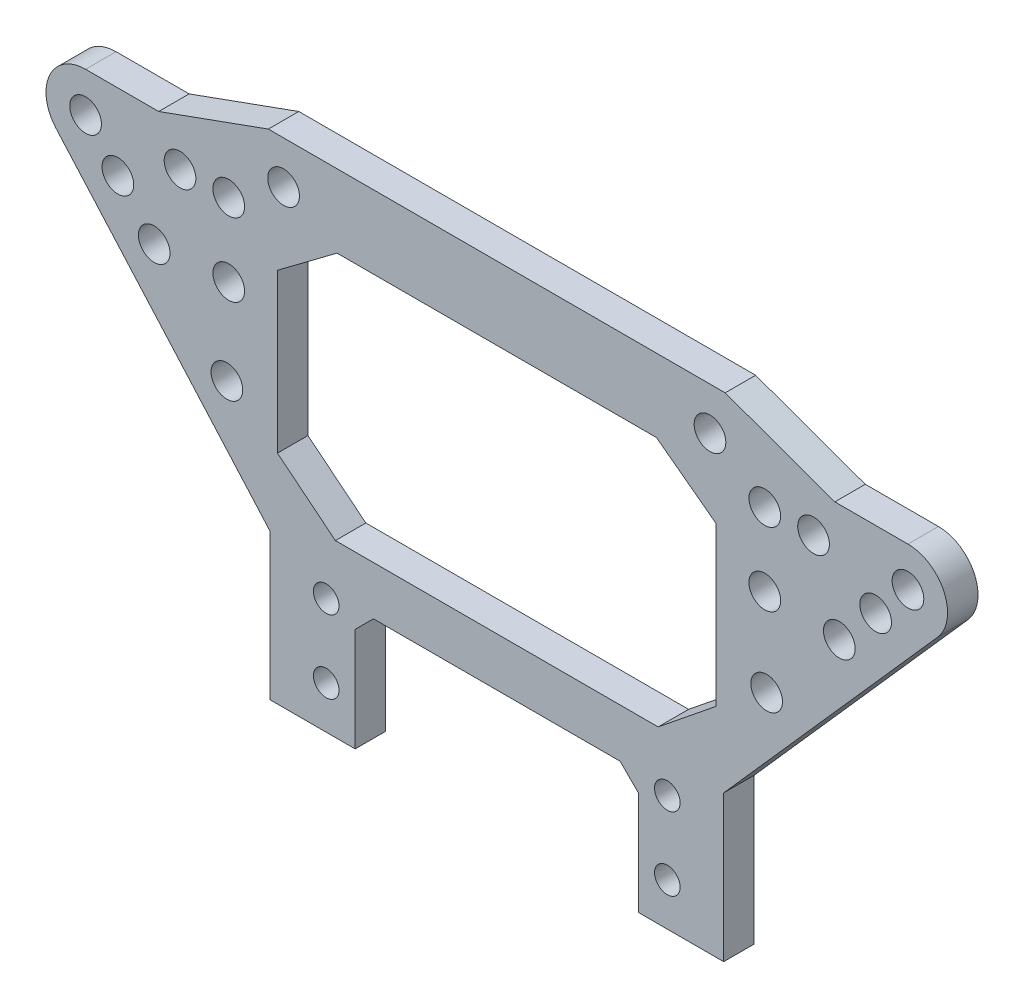
from build123d import *

# Parameters (mm, degrees)
SKETCH_2_R          = 2.1
SKETCH_2_R_2        = 2.6
EXTRUDE_1_DEPTH     = 5
CUT_EXTRUDE_1_DEPTH = 5
SKETCH_5_W          = 46.5
SKETCH_5_H          = 4
CUT_EXTRUDE_2_DEPTH = 5
CHAMFER_2_SIZE      = 3


with BuildPart() as part:
    # 草图2 → 凸台-拉伸1 (new body)
    with BuildSketch(Plane.XY):
        with BuildLine():
            Line((-23.25, 0), (23.25, 0))
            Line((23.25, 0), (23.25, -16))
            Line((23.25, -16), (37.25, -16))
            Line((37.25, -16), (37.25, 8))
            Line((37.25, 8), (72.368161114, 47.692911962))
            ThreePointArc((72.368161114, 47.692911962), (73.426469111, 54.669637405), (67.5, 58.5))
            Line((67.5, 58.5), (55.5, 58.5))
            Line((55.5, 58.5), (37.5, 65))
            Line((37.5, 65), (-37.5, 65))
            Line((-37.5, 65), (-55.5, 58.5))
            Line((-55.5, 58.5), (-67.5, 58.5))
            ThreePointArc((-67.5, 58.5), (-73.426469111, 54.669637405), (-72.368161114, 47.692911962))
            Line((-72.368161114, 47.692911962), (-37.25, 8))
            Line((-37.25, 8), (-37.25, -16))
            Line((-37.25, -16), (-23.25, -16))
            Line((-23.25, -16), (-23.25, 0))
        make_face()
        with Locations((28, -9)):
            Circle(SKETCH_2_R, mode=Mode.SUBTRACT)
        with Locations((28, 3)):
            Circle(SKETCH_2_R, mode=Mode.SUBTRACT)
        with Locations((44.307987485, 25.786824772)):
            Circle(SKETCH_2_R_2, mode=Mode.SUBTRACT)
        with Locations((56.235308207, 39.267886318)):
            Circle(SKETCH_2_R_2, mode=Mode.SUBTRACT)
        with Locations((62.198968568, 46.008417091)):
            Circle(SKETCH_2_R_2, mode=Mode.SUBTRACT)
        with Locations((67.5, 52)):
            Circle(SKETCH_2_R_2, mode=Mode.SUBTRACT)
        with Locations((44, 40)):
            Circle(SKETCH_2_R_2, mode=Mode.SUBTRACT)
        with Locations((44, 52)):
            Circle(SKETCH_2_R_2, mode=Mode.SUBTRACT)
        with Locations((52, 52)):
            Circle(SKETCH_2_R_2, mode=Mode.SUBTRACT)
        with Locations((35, 58)):
            Circle(SKETCH_2_R_2, mode=Mode.SUBTRACT)
        with Locations((-67.5, 52)):
            Circle(SKETCH_2_R_2, mode=Mode.SUBTRACT)
        with Locations((-62.198968568, 46.008417091)):
            Circle(SKETCH_2_R_2, mode=Mode.SUBTRACT)
        with Locations((-56.235308207, 39.267886318)):
            Circle(SKETCH_2_R_2, mode=Mode.SUBTRACT)
        with Locations((-44.307987485, 25.786824772)):
            Circle(SKETCH_2_R_2, mode=Mode.SUBTRACT)
        with Locations((-44, 40)):
            Circle(SKETCH_2_R_2, mode=Mode.SUBTRACT)
        with Locations((-52, 52)):
            Circle(SKETCH_2_R_2, mode=Mode.SUBTRACT)
        with Locations((-44, 52)):
            Circle(SKETCH_2_R_2, mode=Mode.SUBTRACT)
        with Locations((-35, 58)):
            Circle(SKETCH_2_R_2, mode=Mode.SUBTRACT)
        with Locations((-28, -9)):
            Circle(SKETCH_2_R, mode=Mode.SUBTRACT)
        with Locations((-28, 3)):
            Circle(SKETCH_2_R, mode=Mode.SUBTRACT)
    extrude(amount=EXTRUDE_1_DEPTH)

    # 草图3 → 切除-拉伸1 (cut)
    with BuildSketch(Plane.XY.offset(5)):
        Polygon((-26.219338455, 53), (26.219338455, 53), (36, 45.675774443), (36, 19.675774443), (26.492733991, 12), (-26.492733991, 12), (-36, 19.675774443), (-36, 45.675774443), align=None)
    extrude(amount=-CUT_EXTRUDE_1_DEPTH, mode=Mode.SUBTRACT)

    # 草图5 → 切除-拉伸2 (cut)
    with BuildSketch(Plane.XY.offset(5)):
        with Locations((0, 2)):
            Rectangle(SKETCH_5_W, SKETCH_5_H)
    extrude(amount=-CUT_EXTRUDE_2_DEPTH, mode=Mode.SUBTRACT)

    # 倒角2
    chamfer_2_edges = [part.edges().sort_by_distance(p)[0] for p in [
        (-23.25, 4, 2.5),
        (23.25, 4, 2.5),
    ]]
    chamfer(chamfer_2_edges, length=CHAMFER_2_SIZE)


solid = part.part
